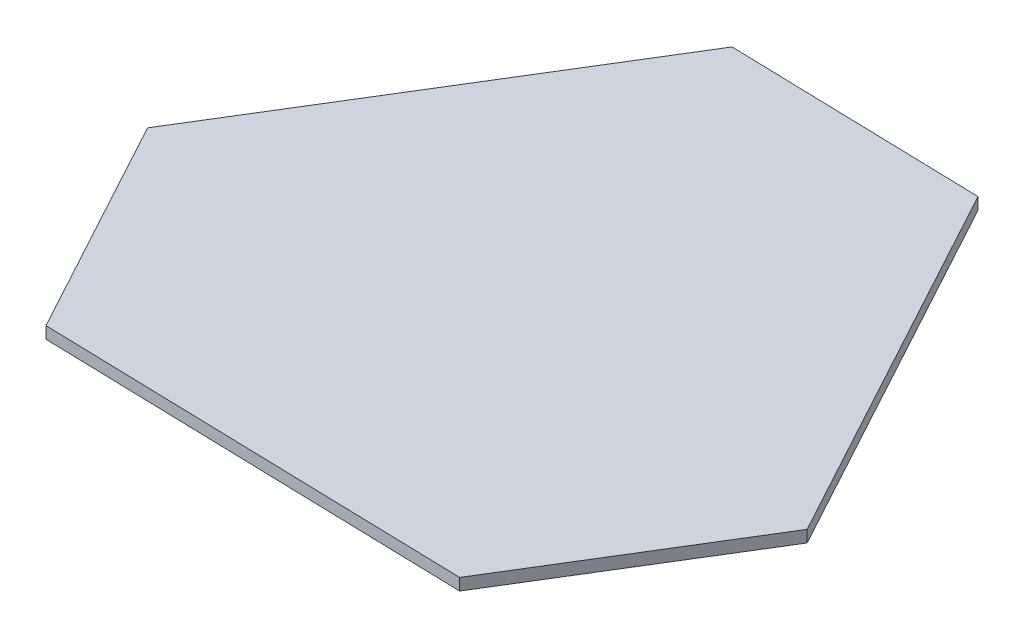
from build123d import *

# Parameters (mm, degrees)
BOSS_EXTRUDE1_DEPTH = 5


with BuildPart() as part:
    # Sketch1 → Boss-Extrude1 (new body)
    with BuildSketch(Plane(origin=(0, 0, 0), x_dir=(1, 0, 0), z_dir=(0, 1, 0))):
        Polygon((48.287518611, 121.62892761), (-58.674992904, 124.461087625), (-152.769535802, -28.986678722), (-101.741002564, -123.035010955), (78.195932695, -127.799392288), (134.129910973, -36.58322007), align=None)
    extrude(amount=BOSS_EXTRUDE1_DEPTH)


solid = part.part
